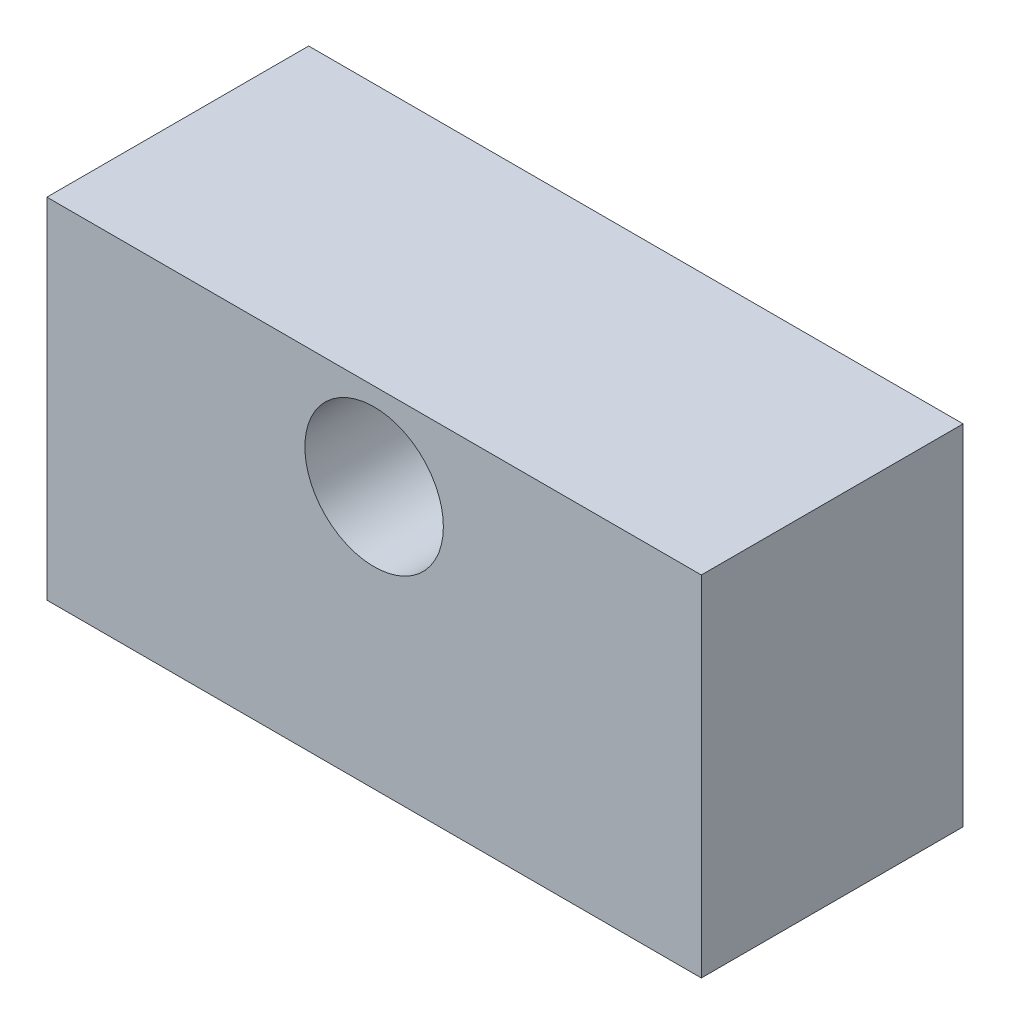
from build123d import *

# Parameters (mm, degrees)
SKETCH1_W           = 30
SKETCH1_H           = 16
SKETCH1_R           = 3.175
BOSS_EXTRUDE1_DEPTH = 12


with BuildPart() as part:
    # Sketch1 → Boss-Extrude1 (new body)
    with BuildSketch(Plane.XY):
        with Locations((0, -4)):
            Rectangle(SKETCH1_W, SKETCH1_H)
        Circle(SKETCH1_R, mode=Mode.SUBTRACT)
    extrude(amount=BOSS_EXTRUDE1_DEPTH)


solid = part.part
